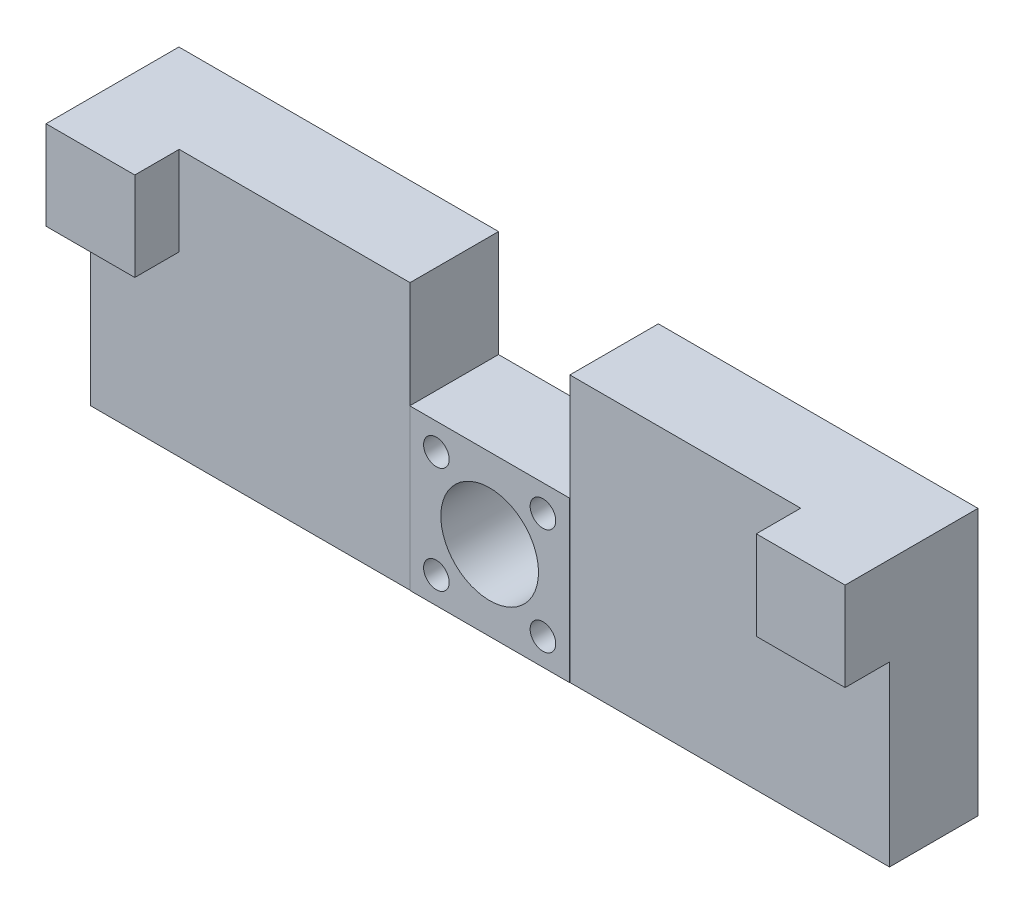
from build123d import *

# Parameters (mm, degrees)
SKETCH_1_W          = 18
SKETCH_1_H          = 18
EXTRUDE_1_DEPTH     = 10
SKETCH_2_R          = 1.441488503
SKETCH_2_R_2        = 5.5
CUT_EXTRUDE_1_DEPTH = 10
SKETCH_3_W          = 36
SKETCH_3_H          = 9.968006468
EXTRUDE_2_DEPTH     = 30
SKETCH_4_W          = 10
SKETCH_4_H          = 10
EXTRUDE_3_DEPTH     = 5


with BuildPart() as part:
    # 草图1 → 凸台-拉伸1 (new body)
    with BuildSketch(Plane.XY):
        Rectangle(SKETCH_1_W, SKETCH_1_H)
    extrude(amount=EXTRUDE_1_DEPTH)

    # 草图2 → 切除-拉伸1 (cut)
    with BuildSketch(Plane.XY.offset(10)):
        with Locations((-6, 6)):
            Circle(SKETCH_2_R)
        with Locations((6, 6)):
            Circle(SKETCH_2_R)
        with Locations((6, -6)):
            Circle(SKETCH_2_R)
        with Locations((-6, -6)):
            Circle(SKETCH_2_R)
        Circle(SKETCH_2_R_2)
    extrude(amount=-CUT_EXTRUDE_1_DEPTH, mode=Mode.SUBTRACT)

    # 草图3 → 凸台-拉伸2 (add)
    with BuildSketch(Plane.XZ.offset(9)):
        with Locations((-27, 4.984003234)):
            Rectangle(SKETCH_3_W, SKETCH_3_H)
        with Locations((27, 4.984003234)):
            Rectangle(SKETCH_3_W, SKETCH_3_H)
    extrude(amount=-EXTRUDE_2_DEPTH)

    # 草图4 → 凸台-拉伸3 (add)
    with BuildSketch(Plane.XY.offset(9.968006468)):
        with Locations((40, 16)):
            Rectangle(SKETCH_4_W, SKETCH_4_H)
        with Locations((-40, 16)):
            Rectangle(SKETCH_4_W, SKETCH_4_H)
    extrude(amount=EXTRUDE_3_DEPTH)


solid = part.part
